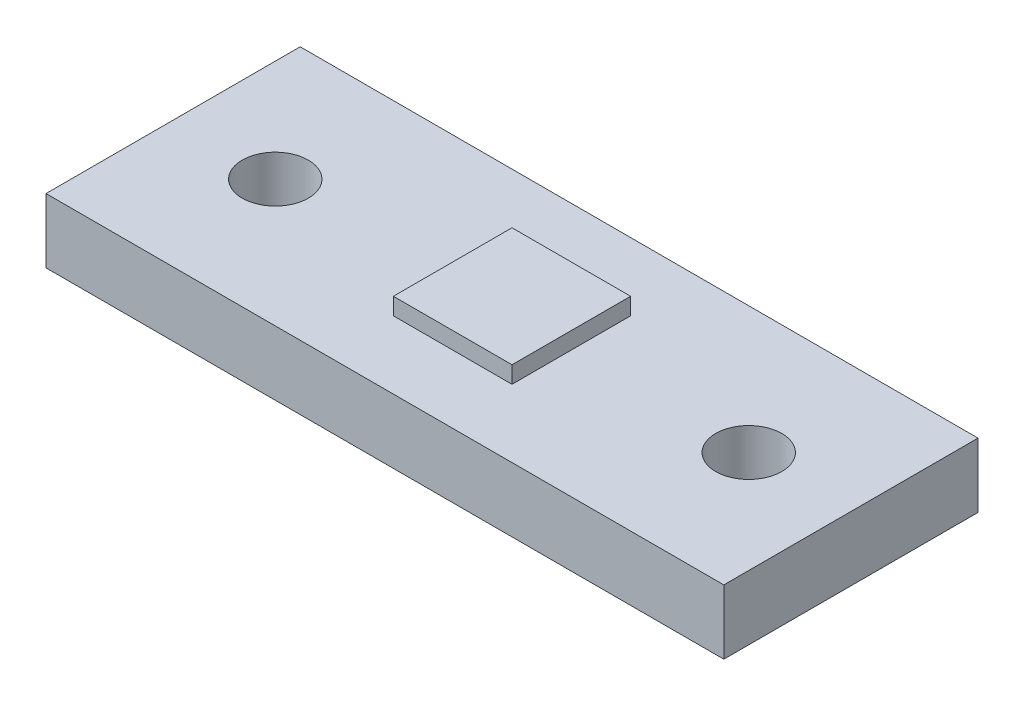
from build123d import *

# Parameters (mm, degrees)
SKETCH1_W           = 40
SKETCH1_H           = 15
SKETCH1_R           = 1.95
BOSS_EXTRUDE1_DEPTH = 3.8
SKETCH3_W           = 7
SKETCH3_H           = 7
BOSS_EXTRUDE2_DEPTH = 1


with BuildPart() as part:
    # Sketch1 → Boss-Extrude1 (new body)
    with BuildSketch(Plane(origin=(0, 0, 0), x_dir=(1, 0, 0), z_dir=(0, 1, 0))):
        with Locations((20, 7.5)):
            Rectangle(SKETCH1_W, SKETCH1_H)
        with Locations(Location((6.03, 7.5, 0), (0, 0, 90))):
            Circle(SKETCH1_R, mode=Mode.SUBTRACT)
        with Locations(Location((33.97, 7.5, 0), (0, 0, 90))):
            Circle(SKETCH1_R, mode=Mode.SUBTRACT)
    extrude(amount=BOSS_EXTRUDE1_DEPTH)

    # Sketch3 → Boss-Extrude2 (add)
    with BuildSketch(Plane(origin=(0, 3.8, 0), x_dir=(1, 0, 0), z_dir=(0, 1, 0))):
        with Locations((20, 7.5)):
            Rectangle(SKETCH3_W, SKETCH3_H)
    extrude(amount=BOSS_EXTRUDE2_DEPTH)


solid = part.part
